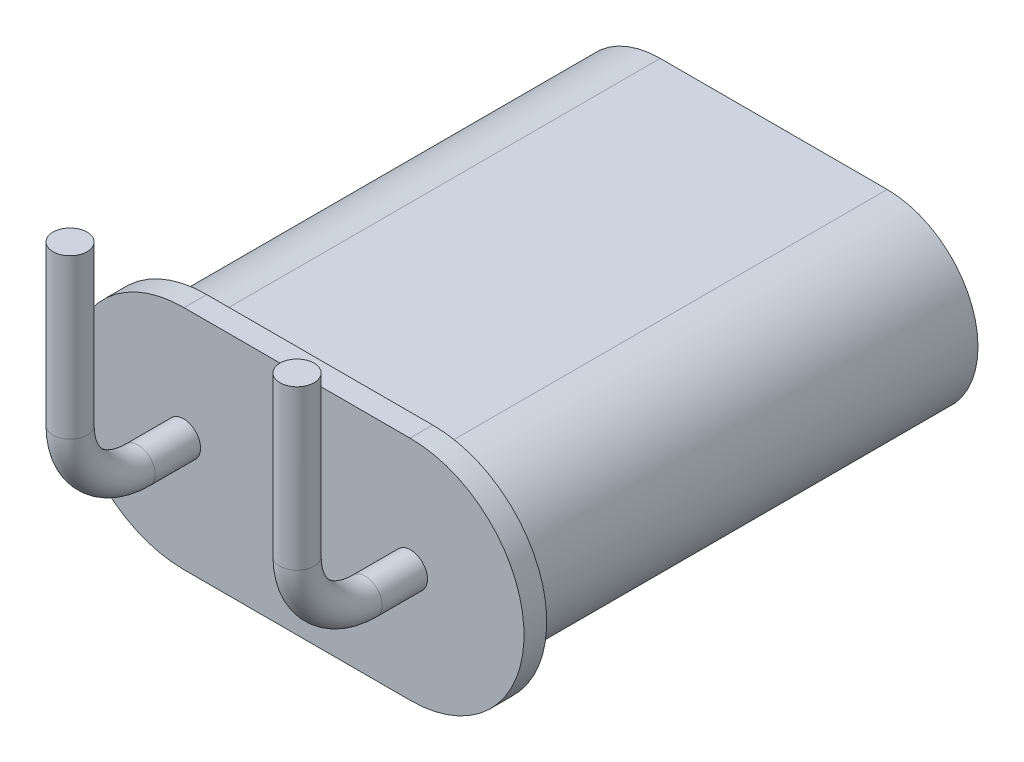
from build123d import *

# Parameters (mm, degrees)
EXTRUDE_1_DEPTH        = 40
EXTRUDE_3_DEPTH        = 2
SKETCH_5_R             = 1.5
PATTERN_LINEAR_1_COUNT = 2
PATTERN_LINEAR_1_PITCH = 20
EXTRUDE_5_DEPTH        = 1


with BuildPart() as part:
    # 草图1 → 凸台-拉伸1 (new body)
    with BuildSketch(Plane.XY):
        with BuildLine():
            Line((-9.12384539, 3.337430199), (10.87615461, 3.337430199))
            ThreePointArc((10.87615461, 3.337430199), (18.87615461, -4.662569801), (10.87615461, -12.662569801))
            Line((10.87615461, -12.662569801), (-9.12384539, -12.662569801))
            ThreePointArc((-9.12384539, -12.662569801), (-17.12384539, -4.662569801), (-9.12384539, 3.337430199))
        make_face()
    extrude(amount=EXTRUDE_1_DEPTH)

    # 草图4 → 凸台-拉伸3 (add)
    with BuildSketch(Plane.XY.offset(40)):
        with BuildLine():
            Line((-9.078973879, 5.337329526), (10.831283099, 5.337329526))
            ThreePointArc((10.831283099, 5.337329526), (20.876053937, -4.61769829), (10.921026121, -14.662469128))
            Line((10.921026121, -14.662469128), (-9.168716901, -14.662469128))
            ThreePointArc((-9.168716901, -14.662469128), (-19.123744717, -4.61769829), (-9.078973879, 5.337329526))
        make_face()
    extrude(amount=EXTRUDE_3_DEPTH)

    # 扫描1: sweep along a path in 草图6
    with BuildLine(Plane(origin=(-9.12384539, 0, 0), x_dir=(0, 0, -1), z_dir=(1, 0, 0))) as sweep_1_path:
        Line((-42, -4.662569801), (-46, -4.662569801))
        ThreePointArc((-46, -4.662569801), (-50.242640687, -2.905210488), (-52, 1.337430199))
        Line((-52, 1.337430199), (-52, 15.337430199))
    # 草图5 → 扫描1 (sweep)
    with BuildSketch(Plane.XY.offset(42)):
        with Locations((-9.12384539, -4.662569801)):
            Circle(SKETCH_5_R)
    sweep_1 = sweep(path=sweep_1_path.line)

    # 阵列(线性)1: 扫描1 ×2
    with Locations(*[(i * PATTERN_LINEAR_1_PITCH, 0, 0) for i in range(1, PATTERN_LINEAR_1_COUNT)]):
        add(sweep_1)

    # 草图8 → 凸台-拉伸5 (add)
    # profile 1 of 5: a face of its own
    with BuildSketch(Plane.XZ.offset(12.662569801)):
        with BuildLine():
            Line((-1.072116938, 20.683563817), (-1.142221348, 20.683563817))
            add(Edge.make_bspline(
                [(-1.142221348, 20.683563817), (-1.147012926, 20.713603859), (-1.15649332, 20.773039701), (-1.165225086, 20.863863364), (-1.175873902, 20.95823769), (-1.194106579, 21.058094174), (-1.222793503, 21.161910815), (-1.263144007, 21.2444437), (-1.301315621, 21.306285568), (-1.333857396, 21.347640916), (-1.371190915, 21.382282287), (-1.411094152, 21.411445439), (-1.454064691, 21.433992539), (-1.49911535, 21.450262111), (-1.546926642, 21.457540965), (-1.595590164, 21.457082455), (-1.642971812, 21.451564165), (-1.686983092, 21.440088651), (-1.726667396, 21.424554088), (-1.763504433, 21.403984059), (-1.797305759, 21.374238294), (-1.832562699, 21.336961786), (-1.867930954, 21.288371292), (-1.9049514, 21.230978958), (-1.940830931, 21.163943663), (-1.972486239, 21.087635334), (-2.000754026, 21.003120269), (-2.033582462, 20.87822232), (-2.064023104, 20.710519111), (-2.082279385, 20.53894003), (-2.09091128, 20.404183888), (-2.095195243, 20.31391824), (-2.098707841, 20.23561884), (-2.098957489, 20.187366914), (-2.099071977, 20.165238652)],
                knots=[0, 0, 0, 0, 1.172618578, 2.320089015, 3.517365984, 4.833421129, 6.231766425, 7.655217032, 8.357323983, 9.032478261, 9.676711985, 10.315215253, 10.932648665, 11.54199308, 12.153444918, 12.786093219, 13.413857257, 13.988112725, 14.53457488, 15.054145165, 15.605211832, 16.262994999, 17.029841423, 17.917944275, 18.895673466, 19.956732694, 21.09950916, 22.329492637, 24.933332206, 27.662278065, 28.97833321, 30.139613505, 31.146829503, 32, 32, 32, 32], degree=3))
            Line((-2.099071977, 20.165238652), (-2.103546727, 19.96909546))
            add(Edge.make_bspline(
                [(-2.103546727, 19.96909546), (-2.091097307, 20.004223909), (-2.06859482, 20.067719035), (-2.034044654, 20.155322259), (-1.994922884, 20.229605808), (-1.949316808, 20.298295381), (-1.890299194, 20.36169248), (-1.830009477, 20.408010985), (-1.773318865, 20.440026652), (-1.722975689, 20.458374918), (-1.666292751, 20.471049487), (-1.626304305, 20.474941084), (-1.605357935, 20.476979543)],
                knots=[0, 0, 0, 0, 1.463710204, 2.645675197, 3.693667506, 4.755032446, 5.874045908, 7.078730407, 7.725382873, 8.423483439, 9.174203962, 10, 10, 10, 10], degree=3))
            add(Edge.make_bspline(
                [(-1.605357935, 20.476979543), (-1.575096686, 20.475822388), (-1.51754814, 20.4736218), (-1.434699134, 20.448853032), (-1.357247884, 20.40538965), (-1.297587429, 20.352245725), (-1.249425614, 20.299798923), (-1.213951506, 20.25177279), (-1.179335063, 20.197448447), (-1.134839699, 20.116046555), (-1.086859021, 20.005032464), (-1.052190242, 19.886406791), (-1.034181698, 19.785897685), (-1.022439043, 19.704882193), (-1.016220634, 19.618418913), (-1.012597199, 19.497540912), (-1.014373086, 19.346669742), (-1.022600279, 19.226756732), (-1.02662365, 19.168115277)],
                knots=[0, 0, 0, 0, 0.909148716, 1.728949998, 2.576991438, 3.564625719, 4.121218537, 4.72026629, 5.360049571, 6.060456872, 7.512703724, 8.993852322, 9.770776208, 10.587253518, 11.458483217, 12.380006039, 14.229702395, 16, 16, 16, 16], degree=3))
            add(Edge.make_bspline(
                [(-1.02662365, 19.168115277), (-1.031323697, 19.137737835), (-1.04107149, 19.074735695), (-1.061726254, 18.977548983), (-1.087063321, 18.874317926), (-1.116171844, 18.768827705), (-1.149875685, 18.668664764), (-1.194465495, 18.583306931), (-1.248392487, 18.516295233), (-1.310701982, 18.470096303), (-1.372238655, 18.439653178), (-1.42727435, 18.416085645), (-1.475178938, 18.399077497), (-1.505823276, 18.395048185), (-1.5195919, 18.3932378)],
                knots=[0, 0, 0, 0, 1.110217054, 2.302565578, 3.587623031, 4.949459538, 6.256081064, 7.397105523, 8.411240029, 9.334418742, 10.173869837, 10.886090718, 11.499516107, 12, 12, 12, 12], degree=3))
            add(Edge.make_bspline(
                [(-1.5195919, 18.3932378), (-1.544718017, 18.391131398), (-1.594813599, 18.386931726), (-1.658083902, 18.398424923), (-1.708822047, 18.416137719), (-1.749938935, 18.437305858), (-1.795633081, 18.462949223), (-1.843243494, 18.496435196), (-1.891616961, 18.535384601), (-1.934902716, 18.583505007), (-1.974790423, 18.637224913), (-2.020779498, 18.718512879), (-2.069147473, 18.826370363), (-2.114021625, 18.938356112), (-2.142908238, 19.037445373), (-2.162494155, 19.126196075), (-2.181015709, 19.229212127), (-2.197016231, 19.341503392), (-2.211132863, 19.452455888), (-2.2229329, 19.551942142), (-2.2329133, 19.634665949), (-2.241993728, 19.722590067), (-2.248328338, 19.820328729), (-2.250376001, 19.935533503), (-2.248415355, 20.056872255), (-2.245856612, 20.140879484), (-2.24450134, 20.185375025)],
                knots=[0, 0, 0, 0, 0.848219995, 1.691151707, 2.144998995, 2.659153853, 3.249319417, 3.912736756, 4.621867519, 5.340468245, 6.090710837, 6.87657341, 8.487178015, 10.078339935, 10.944022033, 11.968008362, 13.14490399, 14.476453821, 15.796264219, 16.920399402, 17.85823784, 18.608902694, 19.903936842, 21.162934464, 22.497310667, 24, 24, 24, 24], degree=3))
            add(Edge.make_bspline(
                [(-2.24450134, 20.185375025), (-2.243603955, 20.220927877), (-2.241915553, 20.287819416), (-2.238094395, 20.381789565), (-2.234147253, 20.462903114), (-2.225701568, 20.555954921), (-2.211787008, 20.669969977), (-2.18984605, 20.809492596), (-2.164103785, 20.949457585), (-2.136040666, 21.062004731), (-2.109036551, 21.148143783), (-2.083654578, 21.214034845), (-2.051753057, 21.28150628), (-2.017096213, 21.350952122), (-1.977519212, 21.416925335), (-1.93393745, 21.476247895), (-1.886896509, 21.526333902), (-1.836541864, 21.568733527), (-1.779703135, 21.600765997), (-1.716272261, 21.623401784), (-1.645324236, 21.63512905), (-1.59594997, 21.635171735), (-1.570305729, 21.635193905)],
                knots=[0, 0, 0, 0, 1.211628523, 2.279639787, 3.204225299, 3.977932759, 5.462339825, 7.116605252, 8.789327199, 10.30942825, 11.064792467, 11.863814246, 12.712679163, 13.606614715, 14.50718602, 15.330439464, 16.109367713, 16.843542067, 17.564206182, 18.319665359, 19.127259812, 20, 20, 20, 20], degree=3))
            add(Edge.make_bspline(
                [(-1.570305729, 21.635193905), (-1.544314532, 21.633042265), (-1.495198387, 21.628976262), (-1.427498497, 21.610541787), (-1.369344373, 21.586063649), (-1.323306328, 21.551365145), (-1.287176999, 21.513101855), (-1.253791429, 21.478346253), (-1.227530878, 21.443128045), (-1.204690479, 21.408581904), (-1.185801526, 21.37022597), (-1.166881235, 21.326851269), (-1.149380331, 21.275806351), (-1.132367651, 21.219982674), (-1.11648696, 21.163774105), (-1.102961546, 21.111577065), (-1.092490706, 21.065566151), (-1.081892422, 21.010063883), (-1.073107897, 20.937158516), (-1.072466166, 20.877254455), (-1.072116938, 20.844654804)],
                knots=[0, 0, 0, 0, 1.358046768, 2.566331314, 3.646368544, 4.629682629, 5.546946845, 6.391627168, 7.141431054, 7.835891544, 8.549473584, 9.368770778, 10.304200405, 11.362836174, 12.414134618, 13.351720444, 14.176238426, 14.875889185, 16.299866179, 18, 18, 18, 18], degree=3))
            Line((-1.072116938, 20.844654804), (-1.072116938, 20.683563817))
        make_face()
        with BuildLine():
            add(Edge.make_bspline(
                [(-2.038662857, 19.440329213), (-2.03715496, 19.39553109), (-2.034060265, 19.303590828), (-2.015255783, 19.164149825), (-1.982560787, 19.022680508), (-1.943490143, 18.906756273), (-1.904732178, 18.818152784), (-1.86991395, 18.758314724), (-1.832164859, 18.703791205), (-1.788992577, 18.656971637), (-1.741516294, 18.617211996), (-1.686653209, 18.59217274), (-1.627255791, 18.577418425), (-1.586302083, 18.57891195), (-1.565085188, 18.579685701)],
                knots=[0, 0, 0, 0, 1.4886747, 3.055242853, 4.666194597, 6.306608966, 7.112592917, 7.87485258, 8.603662743, 9.310999056, 9.986965693, 10.644668568, 11.297843225, 12, 12, 12, 12], degree=3))
            add(Edge.make_bspline(
                [(-1.565085188, 18.579685701), (-1.546787587, 18.581420108), (-1.510113353, 18.584896412), (-1.456856066, 18.604041824), (-1.405651954, 18.632683594), (-1.3575978, 18.671804258), (-1.313942988, 18.718016617), (-1.275088904, 18.769234927), (-1.243688888, 18.825548009), (-1.210871072, 18.908356457), (-1.180596884, 19.02186969), (-1.163944896, 19.168253338), (-1.153693487, 19.321394168), (-1.145788346, 19.479204236), (-1.147578683, 19.642769992), (-1.167207001, 19.751990033), (-1.177273554, 19.808004474)],
                knots=[0, 0, 0, 0, 0.542441635, 1.087226227, 1.660703064, 2.273516638, 2.914006631, 3.539772715, 4.172601069, 4.816509057, 6.173746714, 7.636628278, 9.17189136, 10.71932084, 12.317475397, 14, 14, 14, 14], degree=3))
            add(Edge.make_bspline(
                [(-1.177273554, 19.808004474), (-1.190938683, 19.853944541), (-1.218091115, 19.945226855), (-1.269915295, 20.051416766), (-1.317999127, 20.127255621), (-1.353541697, 20.17671798), (-1.39323921, 20.214837233), (-1.432727957, 20.245575756), (-1.47399646, 20.267041094), (-1.514928838, 20.283711532), (-1.557616372, 20.290916545), (-1.585951348, 20.291157032), (-1.600137394, 20.291277433)],
                knots=[0, 0, 0, 0, 2.076888393, 4.126750173, 5.096135134, 5.973977047, 6.759453719, 7.47553224, 8.136547057, 8.771446398, 9.384918551, 10, 10, 10, 10], degree=3))
            add(Edge.make_bspline(
                [(-1.600137394, 20.291277433), (-1.617421354, 20.28860345), (-1.652224323, 20.283219119), (-1.702366813, 20.264846968), (-1.750428877, 20.238158459), (-1.808659552, 20.191942014), (-1.872408501, 20.12727767), (-1.921692141, 20.05266177), (-1.950711831, 19.986974963), (-1.971501108, 19.930784326), (-1.989897076, 19.865868696), (-2.006986475, 19.793530078), (-2.021007905, 19.713869167), (-2.031504654, 19.628007695), (-2.037256735, 19.536117869), (-2.038184693, 19.472902981), (-2.038662857, 19.440329213)],
                knots=[0, 0, 0, 0, 0.703513377, 1.416593983, 2.138698186, 2.910269809, 4.405335412, 5.780974721, 6.484987373, 7.296510348, 8.193863016, 9.202460595, 10.29132512, 11.452082192, 12.687092747, 14, 14, 14, 14], degree=3))
        make_face(mode=Mode.SUBTRACT)
    # profile 2 of 5: a face of its own
    with BuildSketch(Plane.XZ.offset(12.662569801)):
        with BuildLine():
            add(Edge.make_bspline(
                [(-0.446397781, 20.069777327), (-0.44396739, 20.118024315), (-0.438987974, 20.216873354), (-0.42545149, 20.368385579), (-0.405484734, 20.526447972), (-0.382330909, 20.688774948), (-0.350292255, 20.849131297), (-0.309288775, 21.001628854), (-0.25694456, 21.142626019), (-0.204713221, 21.250893784), (-0.160559221, 21.330274367), (-0.12843297, 21.383080242), (-0.097869317, 21.430702144), (-0.067757105, 21.472076765), (-0.03820187, 21.507308218), (-0.010944444, 21.537856874), (0.016564347, 21.561640473), (0.051064355, 21.585224091), (0.0930583, 21.606258177), (0.141721426, 21.624659175), (0.188545994, 21.635303567), (0.219049892, 21.635229589), (0.233764162, 21.635193905)],
                knots=[0, 0, 0, 0, 1.583211401, 3.243703523, 4.983978234, 6.804605119, 8.6166428, 10.340282122, 11.974804003, 13.53820457, 14.274983449, 14.951299633, 15.563740824, 16.129235462, 16.626851747, 17.070813204, 17.469389546, 17.815167281, 18.438300608, 19.002855301, 19.519003895, 20, 20, 20, 20], degree=3))
            add(Edge.make_bspline(
                [(0.233764162, 21.635193905), (0.247834348, 21.632733571), (0.277552772, 21.627536963), (0.321488728, 21.608214964), (0.368120418, 21.582518872), (0.417734095, 21.549214456), (0.467268631, 21.504434867), (0.513175324, 21.445125594), (0.555793965, 21.372692248), (0.608756567, 21.258055307), (0.667119562, 21.102672732), (0.712945896, 20.939523264), (0.742713255, 20.803301047), (0.762126336, 20.694617732), (0.777562842, 20.579370051), (0.794139202, 20.417354223), (0.808922267, 20.209746649), (0.811304845, 20.042460057), (0.812498447, 19.958654378)],
                knots=[0, 0, 0, 0, 0.36369769, 0.768186139, 1.217229854, 1.724510149, 2.290946358, 2.914777825, 3.632489608, 4.433551378, 6.137860108, 7.866765886, 8.757390638, 9.699141408, 10.686159515, 11.726895222, 13.859299765, 16, 16, 16, 16], degree=3))
            add(Edge.make_bspline(
                [(0.812498447, 19.958654378), (0.807932904, 19.891501806), (0.798549762, 19.753489262), (0.776227807, 19.542117498), (0.739412785, 19.322225492), (0.693085749, 19.136998191), (0.648275977, 18.989517632), (0.610275741, 18.883097042), (0.567757671, 18.782598028), (0.522377674, 18.688994546), (0.475168319, 18.605670324), (0.426299507, 18.535653846), (0.374659977, 18.481727072), (0.321607135, 18.442991439), (0.269807847, 18.416740867), (0.220313881, 18.399956617), (0.173180599, 18.390640113), (0.142557556, 18.392395433), (0.127861754, 18.3932378)],
                knots=[0, 0, 0, 0, 1.760488992, 3.618172134, 5.557361062, 7.587083219, 8.607294374, 9.588398617, 10.541277716, 11.460251193, 12.307925722, 13.044175775, 13.687957546, 14.251129358, 14.754223989, 15.200440537, 15.616296545, 16, 16, 16, 16], degree=3))
            add(Edge.make_bspline(
                [(0.127861754, 18.3932378), (0.113819506, 18.395211655), (0.084233573, 18.399370415), (0.039637192, 18.416870968), (-0.006804035, 18.443834608), (-0.056383241, 18.479378226), (-0.106306761, 18.528209831), (-0.154380168, 18.591370145), (-0.200481922, 18.669202364), (-0.244293857, 18.760221695), (-0.285443949, 18.861601737), (-0.321476042, 18.970992367), (-0.354859061, 19.085943717), (-0.381607849, 19.206131395), (-0.403619272, 19.327600408), (-0.420889843, 19.446998937), (-0.433007912, 19.562930172), (-0.439547717, 19.674931725), (-0.441834516, 19.782147426), (-0.444251338, 19.883570956), (-0.445763275, 19.978786764), (-0.446191486, 20.040193861), (-0.446397781, 20.069777327)],
                knots=[0, 0, 0, 0, 0.451175502, 0.950591959, 1.515271951, 2.162531354, 2.891688268, 3.734081857, 4.687580886, 5.773002708, 6.954198864, 8.17563603, 9.445923076, 10.771603705, 12.101713585, 13.383756751, 14.619631726, 15.819374781, 16.961914306, 18.040825747, 19.056148764, 20, 20, 20, 20], degree=3))
        make_face()
        with BuildLine():
            add(Edge.make_bspline(
                [(-0.315138459, 20.059336244), (-0.315669204, 20.035223427), (-0.316796251, 19.984019383), (-0.317868109, 19.902466301), (-0.315868486, 19.811719715), (-0.312451788, 19.677809164), (-0.299907773, 19.502804878), (-0.267847555, 19.292704162), (-0.222059431, 19.089238309), (-0.171605053, 18.929799026), (-0.124632417, 18.816140809), (-0.088587625, 18.745600423), (-0.0506672, 18.688613412), (-0.010938083, 18.645205942), (0.029248907, 18.61444376), (0.066805134, 18.59246176), (0.102394331, 18.577367291), (0.126245649, 18.575398738), (0.137557045, 18.57446516)],
                knots=[0, 0, 0, 0, 0.705717407, 1.498604912, 2.386138873, 3.361274458, 5.418191474, 7.514713171, 9.57394393, 11.515405308, 12.398906158, 13.169972934, 13.829695216, 14.395845116, 14.883250105, 15.303691084, 15.669778158, 16, 16, 16, 16], degree=3))
            add(Edge.make_bspline(
                [(0.137557045, 18.57446516), (0.148028858, 18.574599847), (0.170522172, 18.574889153), (0.205714014, 18.583352186), (0.242710988, 18.60116715), (0.28374894, 18.624577569), (0.325908188, 18.660606835), (0.367520117, 18.709844934), (0.408306084, 18.772949239), (0.448982453, 18.847568076), (0.487459347, 18.930585887), (0.521926548, 19.018540315), (0.551922249, 19.109333841), (0.584362856, 19.236360124), (0.617713363, 19.401108307), (0.647669741, 19.602292751), (0.667535806, 19.800689359), (0.675808976, 19.962543049), (0.678110257, 20.090659527), (0.676197758, 20.19260933), (0.672589398, 20.302012224), (0.668457791, 20.377547089), (0.666323293, 20.416570423)],
                knots=[0, 0, 0, 0, 0.308126263, 0.661851094, 1.055455993, 1.515432549, 2.051181639, 2.679899785, 3.409545513, 4.262246801, 5.183512362, 6.104777924, 7.045624675, 8.000099589, 9.967578284, 11.997814557, 13.993544283, 15.842664909, 16.77344086, 17.770161498, 18.848005724, 20, 20, 20, 20], degree=3))
            add(Edge.make_bspline(
                [(0.666323293, 20.416570423), (0.662726471, 20.453127345), (0.655745093, 20.524083805), (0.643471306, 20.626632541), (0.628240862, 20.721807377), (0.60678005, 20.839060784), (0.572136672, 20.979753102), (0.524417866, 21.113696438), (0.483260952, 21.214824927), (0.447885411, 21.278899371), (0.411905694, 21.333276169), (0.371923177, 21.374772518), (0.333004754, 21.4071091), (0.296375252, 21.431277558), (0.26216317, 21.448341647), (0.23912497, 21.452196176), (0.228543621, 21.453966545)],
                knots=[0, 0, 0, 0, 1.302834758, 2.528783491, 3.662347304, 4.720685654, 6.75648594, 8.792057095, 9.759925264, 10.624039914, 11.384659521, 12.06448684, 12.659424566, 13.175428451, 13.621277708, 14, 14, 14, 14], degree=3))
            add(Edge.make_bspline(
                [(0.228543621, 21.453966545), (0.21704115, 21.453129523), (0.192870368, 21.451370643), (0.155971476, 21.440060476), (0.116807858, 21.42237511), (0.073781217, 21.397843439), (0.028959769, 21.358470411), (-0.016297925, 21.300836436), (-0.063127858, 21.22438879), (-0.112005771, 21.130281815), (-0.158707332, 21.019405154), (-0.198386366, 20.89240591), (-0.23267428, 20.751432567), (-0.258500779, 20.600459718), (-0.279363416, 20.449360408), (-0.295630433, 20.307335177), (-0.308092518, 20.178810529), (-0.312879672, 20.097637292), (-0.315138459, 20.059336244)],
                knots=[0, 0, 0, 0, 0.347392606, 0.729995465, 1.156884588, 1.644891073, 2.219813456, 2.945627096, 3.849684979, 4.924243867, 6.145708801, 7.477723151, 8.938118981, 10.524254447, 12.100980159, 13.544449593, 14.841364989, 16, 16, 16, 16], degree=3))
        make_face(mode=Mode.SUBTRACT)
    # profile 3 of 5: a face of its own
    with BuildSketch(Plane.XZ.offset(12.662569801)):
        with BuildLine():
            add(Edge.make_bspline(
                [(1.367367401, 20.069777327), (1.369797792, 20.118024315), (1.374777209, 20.216873354), (1.388313693, 20.368385579), (1.408280449, 20.526447972), (1.431434273, 20.688774948), (1.463472927, 20.849131297), (1.504476407, 21.001628854), (1.556820622, 21.142626019), (1.609051961, 21.250893784), (1.653205961, 21.330274367), (1.685332212, 21.383080242), (1.715895865, 21.430702144), (1.746008077, 21.472076765), (1.775563312, 21.507308218), (1.802820738, 21.537856874), (1.830329529, 21.561640473), (1.864829538, 21.585224091), (1.906823482, 21.606258177), (1.955486608, 21.624659175), (2.002311176, 21.635303567), (2.032815074, 21.635229589), (2.047529344, 21.635193905)],
                knots=[0, 0, 0, 0, 1.583211401, 3.243703523, 4.983978234, 6.804605119, 8.6166428, 10.340282122, 11.974804003, 13.53820457, 14.274983449, 14.951299633, 15.563740824, 16.129235462, 16.626851747, 17.070813204, 17.469389546, 17.815167281, 18.438300608, 19.002855301, 19.519003895, 20, 20, 20, 20], degree=3))
            add(Edge.make_bspline(
                [(2.047529344, 21.635193905), (2.06159953, 21.632733571), (2.091317954, 21.627536963), (2.135253911, 21.608214964), (2.1818856, 21.582518872), (2.231499278, 21.549214456), (2.281033814, 21.504434867), (2.326940506, 21.445125594), (2.369559147, 21.372692248), (2.422521749, 21.258055307), (2.480884744, 21.102672732), (2.526711079, 20.939523264), (2.556478437, 20.803301047), (2.575891518, 20.694617732), (2.591328024, 20.579370051), (2.607904384, 20.417354223), (2.622687449, 20.209746649), (2.625070027, 20.042460057), (2.626263629, 19.958654378)],
                knots=[0, 0, 0, 0, 0.36369769, 0.768186139, 1.217229854, 1.724510149, 2.290946358, 2.914777825, 3.632489608, 4.433551378, 6.137860108, 7.866765886, 8.757390638, 9.699141408, 10.686159515, 11.726895222, 13.859299765, 16, 16, 16, 16], degree=3))
            add(Edge.make_bspline(
                [(2.626263629, 19.958654378), (2.621698087, 19.891501806), (2.612314944, 19.753489262), (2.589992989, 19.542117498), (2.553177967, 19.322225492), (2.506850931, 19.136998191), (2.462041159, 18.989517632), (2.424040923, 18.883097042), (2.381522853, 18.782598028), (2.336142856, 18.688994546), (2.288933502, 18.605670324), (2.240064689, 18.535653846), (2.188425159, 18.481727072), (2.135372317, 18.442991439), (2.08357303, 18.416740867), (2.034079063, 18.399956617), (1.986945781, 18.390640113), (1.956322738, 18.392395433), (1.941626936, 18.3932378)],
                knots=[0, 0, 0, 0, 1.760488992, 3.618172134, 5.557361062, 7.587083219, 8.607294374, 9.588398617, 10.541277716, 11.460251193, 12.307925722, 13.044175775, 13.687957546, 14.251129358, 14.754223989, 15.200440537, 15.616296545, 16, 16, 16, 16], degree=3))
            add(Edge.make_bspline(
                [(1.941626936, 18.3932378), (1.927584688, 18.395211655), (1.897998755, 18.399370415), (1.853402374, 18.416870968), (1.806961147, 18.443834608), (1.757381942, 18.479378226), (1.707458422, 18.528209831), (1.659385015, 18.591370145), (1.613283261, 18.669202364), (1.569471326, 18.760221695), (1.528321234, 18.861601737), (1.49228914, 18.970992367), (1.458906121, 19.085943717), (1.432157333, 19.206131395), (1.41014591, 19.327600408), (1.392875339, 19.446998937), (1.38075727, 19.562930172), (1.374217465, 19.674931725), (1.371930666, 19.782147426), (1.369513844, 19.883570956), (1.368001907, 19.978786764), (1.367573696, 20.040193861), (1.367367401, 20.069777327)],
                knots=[0, 0, 0, 0, 0.451175502, 0.950591959, 1.515271951, 2.162531354, 2.891688268, 3.734081857, 4.687580886, 5.773002708, 6.954198864, 8.17563603, 9.445923076, 10.771603705, 12.101713585, 13.383756751, 14.619631726, 15.819374781, 16.961914306, 18.040825747, 19.056148764, 20, 20, 20, 20], degree=3))
        make_face()
        with BuildLine():
            add(Edge.make_bspline(
                [(1.498626723, 20.059336244), (1.498095978, 20.035223427), (1.496968931, 19.984019383), (1.495897073, 19.902466301), (1.497896696, 19.811719715), (1.501313394, 19.677809164), (1.513857409, 19.502804878), (1.545917627, 19.292704162), (1.591705751, 19.089238309), (1.642160129, 18.929799026), (1.689132766, 18.816140809), (1.725177557, 18.745600423), (1.763097982, 18.688613412), (1.802827099, 18.645205942), (1.843014089, 18.61444376), (1.880570316, 18.59246176), (1.916159513, 18.577367291), (1.940010831, 18.575398738), (1.951322227, 18.57446516)],
                knots=[0, 0, 0, 0, 0.705717407, 1.498604912, 2.386138873, 3.361274458, 5.418191474, 7.514713171, 9.57394393, 11.515405308, 12.398906158, 13.169972934, 13.829695216, 14.395845116, 14.883250105, 15.303691084, 15.669778158, 16, 16, 16, 16], degree=3))
            add(Edge.make_bspline(
                [(1.951322227, 18.57446516), (1.96179404, 18.574599847), (1.984287354, 18.574889153), (2.019479196, 18.583352186), (2.05647617, 18.60116715), (2.097514122, 18.624577569), (2.13967337, 18.660606835), (2.1812853, 18.709844934), (2.222071266, 18.772949239), (2.262747635, 18.847568076), (2.30122453, 18.930585887), (2.33569173, 19.018540315), (2.365687431, 19.109333841), (2.398128038, 19.236360124), (2.431478545, 19.401108307), (2.461434923, 19.602292751), (2.481300988, 19.800689359), (2.489574159, 19.962543049), (2.491875439, 20.090659527), (2.489962941, 20.19260933), (2.48635458, 20.302012224), (2.482222973, 20.377547089), (2.480088475, 20.416570423)],
                knots=[0, 0, 0, 0, 0.308126263, 0.661851094, 1.055455993, 1.515432549, 2.051181639, 2.679899785, 3.409545513, 4.262246801, 5.183512362, 6.104777924, 7.045624675, 8.000099589, 9.967578284, 11.997814557, 13.993544283, 15.842664909, 16.77344086, 17.770161498, 18.848005724, 20, 20, 20, 20], degree=3))
            add(Edge.make_bspline(
                [(2.480088475, 20.416570423), (2.476491653, 20.453127345), (2.469510275, 20.524083805), (2.457236488, 20.626632541), (2.442006044, 20.721807377), (2.420545232, 20.839060784), (2.385901854, 20.979753102), (2.338183049, 21.113696438), (2.297026134, 21.214824927), (2.261650593, 21.278899371), (2.225670876, 21.333276169), (2.185688359, 21.374772518), (2.146769936, 21.4071091), (2.110140435, 21.431277558), (2.075928352, 21.448341647), (2.052890152, 21.452196176), (2.042308803, 21.453966545)],
                knots=[0, 0, 0, 0, 1.302834758, 2.528783491, 3.662347304, 4.720685654, 6.75648594, 8.792057095, 9.759925264, 10.624039914, 11.384659521, 12.06448684, 12.659424566, 13.175428451, 13.621277708, 14, 14, 14, 14], degree=3))
            add(Edge.make_bspline(
                [(2.042308803, 21.453966545), (2.030806333, 21.453129523), (2.00663555, 21.451370643), (1.969736659, 21.440060476), (1.930573041, 21.42237511), (1.887546399, 21.397843439), (1.842724951, 21.358470411), (1.797467258, 21.300836436), (1.750637325, 21.22438879), (1.701759411, 21.130281815), (1.65505785, 21.019405154), (1.615378817, 20.89240591), (1.581090903, 20.751432567), (1.555264403, 20.600459718), (1.534401766, 20.449360408), (1.518134749, 20.307335177), (1.505672664, 20.178810529), (1.50088551, 20.097637292), (1.498626723, 20.059336244)],
                knots=[0, 0, 0, 0, 0.347392606, 0.729995465, 1.156884588, 1.644891073, 2.219813456, 2.945627096, 3.849684979, 4.924243867, 6.145708801, 7.477723151, 8.938118981, 10.524254447, 12.100980159, 13.544449593, 14.841364989, 16, 16, 16, 16], degree=3))
        make_face(mode=Mode.SUBTRACT)
    # profile 4 of 5: a face of its own
    with BuildSketch(Plane.XZ.offset(12.662569801)):
        with BuildLine():
            Line((3.34222357, 18.76538781), (3.347444111, 18.056139995))
            Line((3.347444111, 18.056139995), (3.332528279, 17.713821648))
            add(Edge.make_bspline(
                [(3.332528279, 17.713821648), (3.33339764, 17.697169247), (3.335031903, 17.665865364), (3.335487311, 17.621844692), (3.335900728, 17.583537952), (3.334309543, 17.551206737), (3.332203641, 17.52455997), (3.329350782, 17.504117807), (3.326283543, 17.488994022), (3.317492473, 17.47400708), (3.304546354, 17.466357815), (3.291469339, 17.451205752), (3.281563681, 17.459844798), (3.275266056, 17.472932331), (3.263565475, 17.494112236), (3.256226838, 17.511878618), (3.251982785, 17.522153206)],
                knots=[0, 0, 0, 0, 1.973355833, 3.709597049, 5.210200201, 6.50617496, 7.539776762, 8.372001597, 8.950083442, 9.358849035, 10.358385362, 10.913548571, 11.166659873, 11.721823082, 12.682493196, 14, 14, 14, 14], degree=3))
            Line((3.251982785, 17.522153206), (3.171437292, 17.723516939))
            add(Edge.make_bspline(
                [(3.171437292, 17.723516939), (3.165972164, 17.737354772), (3.156113292, 17.762317671), (3.146139828, 17.796731671), (3.138651428, 17.822879595), (3.134994534, 17.849099129), (3.140549916, 17.879749313), (3.153035339, 17.915745034), (3.169137433, 17.950516648), (3.180218345, 17.987545637), (3.187728168, 18.032083395), (3.194314495, 18.087853396), (3.199758913, 18.149059973), (3.203209499, 18.201293952), (3.205395973, 18.246795433), (3.205699268, 18.293552424), (3.206765406, 18.353706805), (3.206587398, 18.398457452), (3.206489498, 18.423069464)],
                knots=[0, 0, 0, 0, 1.000378322, 1.804642483, 2.409114764, 2.830277008, 3.573053683, 4.472248352, 5.394786655, 6.146176606, 7.064763978, 8.429895574, 9.924555058, 11.198516356, 11.951951416, 12.989128646, 14.344077541, 16, 16, 16, 16], degree=3))
            Line((3.206489498, 18.423069464), (3.206489498, 20.255479436))
            add(Edge.make_bspline(
                [(3.206489498, 20.255479436), (3.206230755, 20.285318236), (3.205749695, 20.340795271), (3.201429219, 20.421831221), (3.196077427, 20.502894144), (3.189602582, 20.572914701), (3.185464103, 20.629705399), (3.180872839, 20.665978202), (3.176588187, 20.694874932), (3.172998611, 20.711419715), (3.171437292, 20.718616023)],
                knots=[0, 0, 0, 0, 1.540022944, 2.863248753, 4.187966922, 5.733113328, 6.49289986, 7.126351405, 7.619998394, 8, 8, 8, 8], degree=3))
            Line((3.171437292, 20.718616023), (3.146080378, 20.799161516))
            Line((3.146080378, 20.799161516), (3.191573665, 20.849875345))
            Line((3.191573665, 20.849875345), (3.378021567, 20.456843169))
            add(Edge.make_bspline(
                [(3.378021567, 20.456843169), (3.39231249, 20.486605969), (3.418763393, 20.541693586), (3.462458454, 20.618424053), (3.517626842, 20.683259328), (3.576042807, 20.725008703), (3.627268992, 20.752565708), (3.666111227, 20.767495888), (3.703712789, 20.777154826), (3.728491627, 20.778415432), (3.740476286, 20.779025143)],
                knots=[0, 0, 0, 0, 1.545459535, 2.860472957, 4.122532064, 5.495566189, 6.193015, 6.841268075, 7.43956181, 8, 8, 8, 8], degree=3))
            add(Edge.make_bspline(
                [(3.740476286, 20.779025143), (3.752504863, 20.777194775), (3.777938309, 20.773324611), (3.816645889, 20.758370184), (3.856606107, 20.734622435), (3.891377835, 20.709238362), (3.919577202, 20.681863443), (3.94255663, 20.654935828), (3.966528744, 20.621798931), (3.990823494, 20.582222905), (4.016209, 20.536316851), (4.042945397, 20.484393379), (4.070348252, 20.426102203), (4.099049339, 20.36214966), (4.126356827, 20.291050565), (4.149093544, 20.211652857), (4.168406779, 20.124755606), (4.183124615, 20.029814833), (4.194071335, 19.927516614), (4.201379126, 19.817304121), (4.205360702, 19.699392093), (4.204208312, 19.618078127), (4.203612873, 19.576063285)],
                knots=[0, 0, 0, 0, 0.530316349, 1.121310729, 1.797453991, 2.557585726, 2.995327009, 3.511216408, 4.10201123, 4.779983204, 5.538328857, 6.39309346, 7.330561314, 8.35154066, 9.454734208, 10.65400522, 11.955503622, 13.340870068, 14.84824196, 16.448207885, 18.164792685, 20, 20, 20, 20], degree=3))
            add(Edge.make_bspline(
                [(4.203612873, 19.576063285), (4.201852545, 19.534287027), (4.198433783, 19.453152637), (4.189728375, 19.335704483), (4.177158044, 19.226202832), (4.160687998, 19.124981879), (4.141755313, 19.031468749), (4.11848022, 18.946074705), (4.092394874, 18.868456174), (4.060888309, 18.799733724), (4.029818012, 18.737890859), (3.998749654, 18.682976923), (3.971048641, 18.63329683), (3.942957704, 18.590531251), (3.916703206, 18.553389475), (3.891109808, 18.522651157), (3.867693958, 18.497583259), (3.837923343, 18.474096715), (3.802419653, 18.45310014), (3.761493549, 18.434636819), (3.722500884, 18.422804551), (3.696794258, 18.422983956), (3.684541916, 18.423069464)],
                knots=[0, 0, 0, 0, 1.84955169, 3.592046172, 5.208422519, 6.723425389, 8.127442741, 9.426599002, 10.636843962, 11.744465462, 12.767402028, 13.69771882, 14.535208277, 15.282503689, 15.960033569, 16.545760266, 17.051253213, 17.473735524, 18.218680817, 18.868514875, 19.460709349, 20, 20, 20, 20], degree=3))
            add(Edge.make_bspline(
                [(3.684541916, 18.423069464), (3.672263391, 18.424060117), (3.646377572, 18.426148631), (3.60699619, 18.440191033), (3.565053445, 18.461234652), (3.52092934, 18.491217623), (3.47669893, 18.531485345), (3.435781974, 18.584459649), (3.39609983, 18.647720393), (3.37399633, 18.695491313), (3.362359943, 18.720640314)],
                knots=[0, 0, 0, 0, 0.639337142, 1.347862713, 2.158721457, 3.08188101, 4.117715448, 5.260486868, 6.557783286, 8, 8, 8, 8], degree=3))
            Line((3.362359943, 18.720640314), (3.34222357, 18.76538781))
        make_face()
        with BuildLine():
            add(Edge.make_bspline(
                [(3.347444111, 19.61111549), (3.346478567, 19.576562718), (3.344603235, 19.509452456), (3.345491408, 19.411960112), (3.348722851, 19.320360199), (3.356680335, 19.235119934), (3.365484172, 19.155780345), (3.379705065, 19.083081884), (3.39427684, 19.015924635), (3.420036491, 18.938831547), (3.451941916, 18.8560405), (3.490509484, 18.77310952), (3.525325852, 18.710057399), (3.559551885, 18.665953738), (3.594079413, 18.639476997), (3.623489731, 18.619050709), (3.652340495, 18.606942378), (3.671280414, 18.605135216), (3.680067166, 18.604296824)],
                knots=[0, 0, 0, 0, 1.474644415, 2.864134115, 4.159211264, 5.383559591, 6.516270356, 7.562663161, 8.542888092, 9.445187494, 11.0268342, 12.326939784, 13.34389075, 14.097622956, 14.685685224, 15.191693374, 15.625004212, 16, 16, 16, 16], degree=3))
            add(Edge.make_bspline(
                [(3.680067166, 18.604296824), (3.689563056, 18.604362542), (3.709170967, 18.604498242), (3.739061649, 18.613404384), (3.768869173, 18.629802518), (3.80194196, 18.653352975), (3.836613707, 18.692827938), (3.873665696, 18.751000378), (3.914826113, 18.829110984), (3.951584548, 18.906739263), (3.98056575, 18.980398041), (4.00067093, 19.04485895), (4.016281709, 19.116422569), (4.032044918, 19.194027815), (4.042242298, 19.278861784), (4.051624138, 19.370317977), (4.057265196, 19.468355423), (4.060205607, 19.571319635), (4.060066193, 19.675516722), (4.057717457, 19.777556192), (4.049867268, 19.875287464), (4.039387791, 19.968793562), (4.026639712, 20.058345188), (4.008174358, 20.143258018), (3.987953265, 20.224176439), (3.970519399, 20.275716754), (3.961976393, 20.300972724)],
                knots=[0, 0, 0, 0, 0.368856855, 0.761646613, 1.199566916, 1.692023083, 2.33690364, 3.2321614, 4.377125348, 5.777872099, 6.578908284, 7.46190745, 8.407145079, 9.433724558, 10.548290405, 11.736585136, 13.018454153, 14.376075958, 15.752530657, 17.081084555, 18.354606857, 19.573850622, 20.750064997, 21.87932905, 22.960821192, 24, 24, 24, 24], degree=3))
            add(Edge.make_bspline(
                [(3.961976393, 20.300972724), (3.952211278, 20.325039952), (3.933993855, 20.36993885), (3.902399281, 20.429550189), (3.872078445, 20.478709524), (3.838160547, 20.514151721), (3.806038529, 20.540670811), (3.775700419, 20.559283565), (3.748088089, 20.573579527), (3.729174675, 20.576361776), (3.720339913, 20.577661409)],
                knots=[0, 0, 0, 0, 1.622513621, 3.026899241, 4.216725868, 5.2174103, 6.079171244, 6.812333136, 7.445221541, 8, 8, 8, 8], degree=3))
            add(Edge.make_bspline(
                [(3.720339913, 20.577661409), (3.711553236, 20.577087882), (3.692431238, 20.575839743), (3.663662012, 20.564225201), (3.632729383, 20.547456428), (3.597998914, 20.523742108), (3.561263769, 20.484179945), (3.523557677, 20.425089438), (3.483373028, 20.345193921), (3.447766104, 20.266081598), (3.420677238, 20.191263666), (3.402506246, 20.1263824), (3.385597246, 20.055621007), (3.373951488, 19.978414802), (3.361848047, 19.895539567), (3.355273422, 19.806082791), (3.349794639, 19.710613134), (3.348243019, 19.644933203), (3.347444111, 19.61111549)],
                knots=[0, 0, 0, 0, 0.381752176, 0.830787781, 1.33501302, 1.918283341, 2.654060147, 3.66993604, 4.964044334, 6.550681541, 7.448752751, 8.429695385, 9.486422994, 10.617700188, 11.831503372, 13.136410585, 14.525576306, 16, 16, 16, 16], degree=3))
        make_face(mode=Mode.SUBTRACT)
    # profile 5 of 5: a face of its own
    with BuildSketch(Plane.XZ.offset(12.662569801)):
        with BuildLine():
            add(Edge.make_bspline(
                [(4.942692353, 20.63359578), (4.960845929, 20.634270801), (5.002915894, 20.635835126), (5.057687025, 20.639364294), (5.105808181, 20.645498287), (5.139008115, 20.656977455), (5.167644618, 20.67237615), (5.182377111, 20.686923009), (5.189549374, 20.6940049)],
                knots=[0, 0, 0, 0, 1.251299182, 2.899820576, 3.783959443, 4.580117436, 5.308754339, 6, 6, 6, 6], degree=3))
            Line((5.189549374, 20.6940049), (5.229822121, 20.734277646))
            Line((5.229822121, 20.734277646), (5.361081443, 20.597797783))
            add(Edge.make_bspline(
                [(5.361081443, 20.597797783), (5.366479008, 20.590750625), (5.375574865, 20.578874912), (5.3799895, 20.558624829), (5.374074552, 20.543779255), (5.366498563, 20.531550033), (5.352714869, 20.522871753), (5.341835955, 20.522616323), (5.335724528, 20.522472831)],
                knots=[0, 0, 0, 0, 1.508023548, 2.541287868, 3.347040681, 4.171598767, 4.972862671, 6, 6, 6, 6], degree=3))
            Line((5.335724528, 20.522472831), (5.260399576, 20.517252289))
            Line((5.260399576, 20.517252289), (5.003101473, 20.476979543))
            Line((5.003101473, 20.476979543), (4.953133435, 20.472504793))
            Line((4.953133435, 20.472504793), (4.953133435, 18.75569252))
            Line((4.953133435, 18.75569252), (4.942692353, 18.428290005))
            add(Edge.make_bspline(
                [(4.942692353, 18.428290005), (4.941003766, 18.405130834), (4.937923304, 18.362881924), (4.93081563, 18.313934954), (4.923314253, 18.283164905), (4.918681081, 18.26896331), (4.910720435, 18.259809959), (4.905015088, 18.261300431), (4.902419606, 18.261978477)],
                knots=[0, 0, 0, 0, 2.315700158, 4.224495302, 4.940508404, 5.451946333, 5.750678831, 6, 6, 6, 6], degree=3))
            add(Edge.make_bspline(
                [(4.902419606, 18.261978477), (4.900425304, 18.262686061), (4.895188291, 18.264544167), (4.884231071, 18.27020922), (4.875458119, 18.290651807), (4.870521578, 18.307285093), (4.867367401, 18.317912848)],
                knots=[0, 0, 0, 0, 0.366648277, 0.962813821, 2.059405152, 4, 4, 4, 4], degree=3))
            Line((4.867367401, 18.317912848), (4.847231027, 18.382796717))
            Line((4.847231027, 18.382796717), (4.786821907, 18.564024077))
            add(Edge.make_bspline(
                [(4.786821907, 18.564024077), (4.781181639, 18.58144008), (4.771353499, 18.611787375), (4.7577752, 18.650739084), (4.750978752, 18.677047053), (4.747137501, 18.699469956), (4.759614117, 18.726310531), (4.772790256, 18.766208026), (4.790212212, 18.816076292), (4.79585933, 18.863472878), (4.799859289, 18.905312018), (4.802777863, 18.944857553), (4.80553878, 18.992367767), (4.809089093, 19.044569559), (4.812915075, 19.094997804), (4.814982726, 19.137783122), (4.816550968, 19.169352129), (4.817163253, 19.186759536), (4.817399363, 19.193472191)],
                knots=[0, 0, 0, 0, 1.36790091, 2.383560272, 3.072469001, 3.408695269, 4.048851011, 5.194026511, 6.591712586, 7.962256542, 8.745514325, 9.732257074, 10.922734791, 12.299676451, 13.639574937, 14.699244006, 15.498401594, 16, 16, 16, 16], degree=3))
            Line((4.817399363, 19.193472191), (4.817399363, 20.441927337))
            add(Edge.make_bspline(
                [(4.817399363, 20.441927337), (4.808219862, 20.438643604), (4.788009353, 20.431413807), (4.757000412, 20.421611875), (4.725698894, 20.413949653), (4.70577931, 20.409109945), (4.696581123, 20.406875132)],
                knots=[0, 0, 0, 0, 0.929274808, 2.045984474, 3.097701995, 4, 4, 4, 4], degree=3))
            Line((4.696581123, 20.406875132), (4.636172003, 20.386738759))
            Line((4.636172003, 20.386738759), (4.504912681, 20.517252289))
            add(Edge.make_bspline(
                [(4.504912681, 20.517252289), (4.496794143, 20.524246785), (4.483473054, 20.535723519), (4.475745314, 20.557995822), (4.478928662, 20.573188908), (4.483164402, 20.58021006), (4.484776308, 20.582881951)],
                knots=[0, 0, 0, 0, 1.655309165, 2.716070268, 3.511402149, 4, 4, 4, 4], degree=3))
            add(Edge.make_bspline(
                [(4.484776308, 20.582881951), (4.488017504, 20.582441595), (4.497299847, 20.581180476), (4.511401334, 20.577036402), (4.531062401, 20.576677267), (4.555189975, 20.578416992), (4.587768858, 20.582368119), (4.612070046, 20.586038944), (4.625730921, 20.588102492)],
                knots=[0, 0, 0, 0, 0.414002874, 1.185647863, 1.847394037, 2.888009764, 4.250599451, 6, 6, 6, 6], degree=3))
            Line((4.625730921, 20.588102492), (4.696581123, 20.597797783))
            Line((4.696581123, 20.597797783), (4.817399363, 20.617934156))
            add(Edge.make_bspline(
                [(4.817399363, 20.617934156), (4.817271139, 20.644786021), (4.817014647, 20.698498956), (4.814919332, 20.764595493), (4.81321034, 20.814580641), (4.814596232, 20.846383545), (4.814551642, 20.872820773), (4.816521357, 20.888416699), (4.817399363, 20.895368633)],
                knots=[0, 0, 0, 0, 1.740875534, 3.482347922, 4.288435439, 4.981719498, 5.546098159, 6, 6, 6, 6], degree=3))
            add(Edge.make_bspline(
                [(4.817399363, 20.895368633), (4.817769178, 20.941862708), (4.818475727, 21.030691741), (4.82538075, 21.157748345), (4.839332973, 21.271650303), (4.858806355, 21.371895468), (4.88785689, 21.456035904), (4.926334218, 21.524633983), (4.97811722, 21.57705119), (5.03927218, 21.613350008), (5.104230648, 21.638728553), (5.148597852, 21.636322649), (5.169413001, 21.635193905)],
                knots=[0, 0, 0, 0, 1.512463055, 2.889629039, 4.136443639, 5.24350599, 6.20528083, 7.020825521, 7.781390295, 8.569198309, 9.328730524, 10, 10, 10, 10], degree=3))
            add(Edge.make_bspline(
                [(5.169413001, 21.635193905), (5.181561513, 21.631463238), (5.205902964, 21.62398826), (5.238531356, 21.603814723), (5.268708015, 21.579029582), (5.30153636, 21.536152562), (5.337458656, 21.476565441), (5.362354691, 21.397100053), (5.377562648, 21.318570874), (5.380037507, 21.266835404), (5.381217816, 21.242161729)],
                knots=[0, 0, 0, 0, 0.637227762, 1.276785881, 1.916099099, 2.592314186, 3.983105826, 5.395849431, 6.758028742, 8, 8, 8, 8], degree=3))
            Line((5.381217816, 21.242161729), (5.381217816, 21.116868739))
            Line((5.381217816, 21.116868739), (5.325283446, 21.116868739))
            add(Edge.make_bspline(
                [(5.325283446, 21.116868739), (5.322448266, 21.13326111), (5.316832577, 21.165729747), (5.310107456, 21.215271705), (5.30414573, 21.267113975), (5.293249074, 21.320738579), (5.277113981, 21.375346588), (5.248141322, 21.41330929), (5.22001512, 21.436487233), (5.196875346, 21.450083721), (5.170658767, 21.455333076), (5.135189789, 21.457686857), (5.089722076, 21.44718174), (5.04418457, 21.4154562), (5.008314506, 21.374467253), (4.986547079, 21.326219063), (4.975209698, 21.276000383), (4.966397105, 21.232441256), (4.961674085, 21.192731778), (4.95822516, 21.155391133), (4.953294721, 21.110725984), (4.950089738, 21.06095176), (4.94722547, 21.010976915), (4.944950258, 20.965234842), (4.94336826, 20.925706802), (4.942905014, 20.901335968), (4.942692353, 20.890148092)],
                knots=[0, 0, 0, 0, 1.109469972, 2.197545438, 3.33491557, 4.586895958, 5.850679495, 7.094286812, 7.695120629, 8.281362741, 8.860527223, 9.458379216, 10.649013708, 11.881517166, 13.104503081, 14.239453274, 15.369548042, 16.533795947, 17.202214795, 18.035421386, 19.035269295, 20.19892666, 21.361520299, 22.374210065, 23.253651394, 24, 24, 24, 24], degree=3))
            Line((4.942692353, 20.890148092), (4.942692353, 20.63359578))
        make_face()
    extrude(amount=EXTRUDE_5_DEPTH)


solid = part.part
